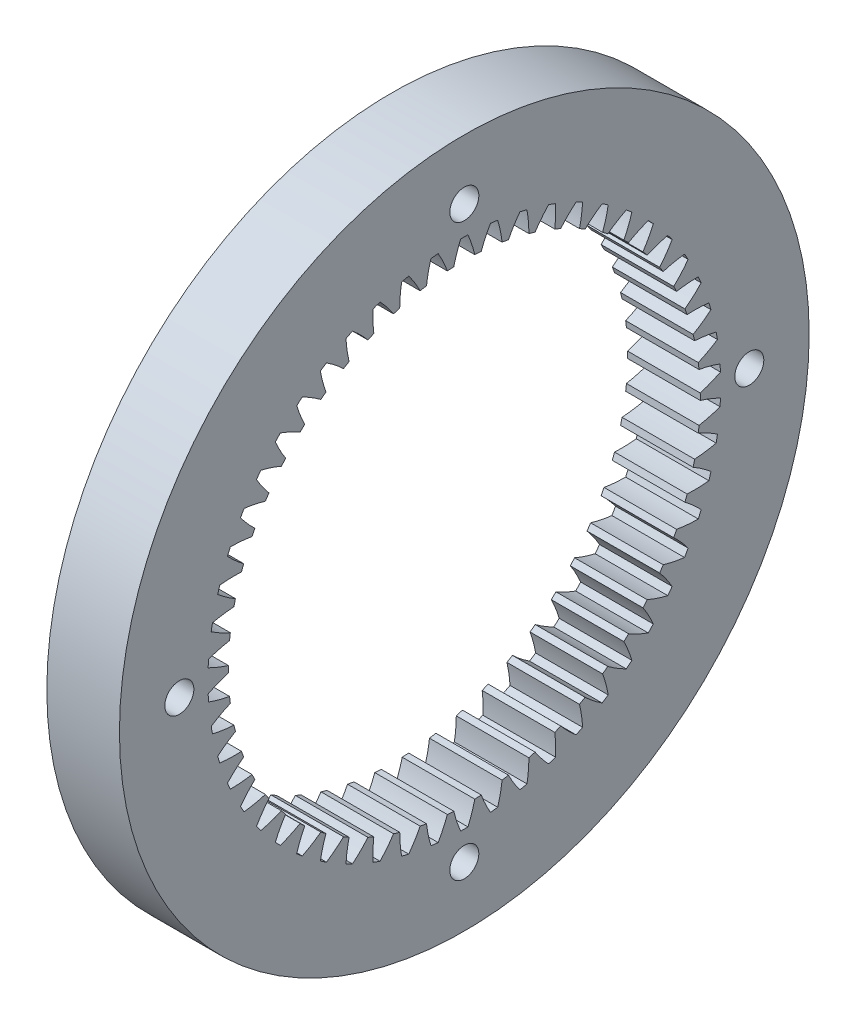
from build123d import *

# Parameters (mm, degrees)
BASPROSKE_W        = 10
BASPROSKE_H        = 15
TOOTHCUT_DEPTH     = 68.915388536
TEETHCUTS_COUNT    = 54
TEETHCUTS_ANGLE    = 353.333333333
SKETCH1_R          = 2
CUT_EXTRUDE1_DEPTH = 10


with BuildPart() as part:
    # BasProSke → Base-Revolve (revolve)
    with BuildSketch(Plane(origin=(0, 0, 0), x_dir=(1, 0, 0), z_dir=(0, 1, 0)), mode=Mode.PRIVATE) as base_revolve_sk:
        with Locations((5, 40)):
            Rectangle(BASPROSKE_W, BASPROSKE_H)
    revolve(base_revolve_sk.sketch.rotate(Axis((-10, 0, 0), (1, 0, 0)), 180), axis=Axis((-10, 0, 0), (1, 0, 0)))

    # TooCutSke → ToothCut (cut, through all)
    with BuildSketch(Plane(origin=(0, 0, 0), x_dir=(0, 0, -1), z_dir=(1, 0, 0))):
        with BuildLine():
            ThreePointArc((1.451555194, 32.44214285), (1.040285966, 33.897379568), (0.500389575, 35.309954581))
            ThreePointArc((0.500389575, 35.309954581), (0, 35.3135), (-0.500389575, 35.309954581))
            ThreePointArc((-0.500389575, 35.309954581), (-1.040285966, 33.897379568), (-1.451555194, 32.44214285))
            ThreePointArc((-1.451555194, 32.44214285), (0, 32.4746), (1.451555194, 32.44214285))
        make_face()
    toothcut = extrude(amount=TOOTHCUT_DEPTH, mode=Mode.SUBTRACT)

    # TeethCuts: ToothCut ×54 about axis
    teethcuts_axis = Axis((-10, 0, 0), (1, 0, 0))
    for i in range(1, TEETHCUTS_COUNT):
        add(toothcut.rotate(teethcuts_axis, i * TEETHCUTS_ANGLE / (TEETHCUTS_COUNT - 1)), mode=Mode.SUBTRACT)

    # Sketch1 → Cut-Extrude1 (cut)
    with BuildSketch(Plane(origin=(10, 0, 0), x_dir=(0, 0, -1), z_dir=(1, 0, 0))):
        with Locations((0, 39.25)):
            Circle(SKETCH1_R)
        with Locations((39.25, 0)):
            Circle(SKETCH1_R)
        with Locations((0, -39.25)):
            Circle(SKETCH1_R)
        with Locations((-39.25, 0)):
            Circle(SKETCH1_R)
    extrude(amount=-CUT_EXTRUDE1_DEPTH, mode=Mode.SUBTRACT)


solid = part.part
